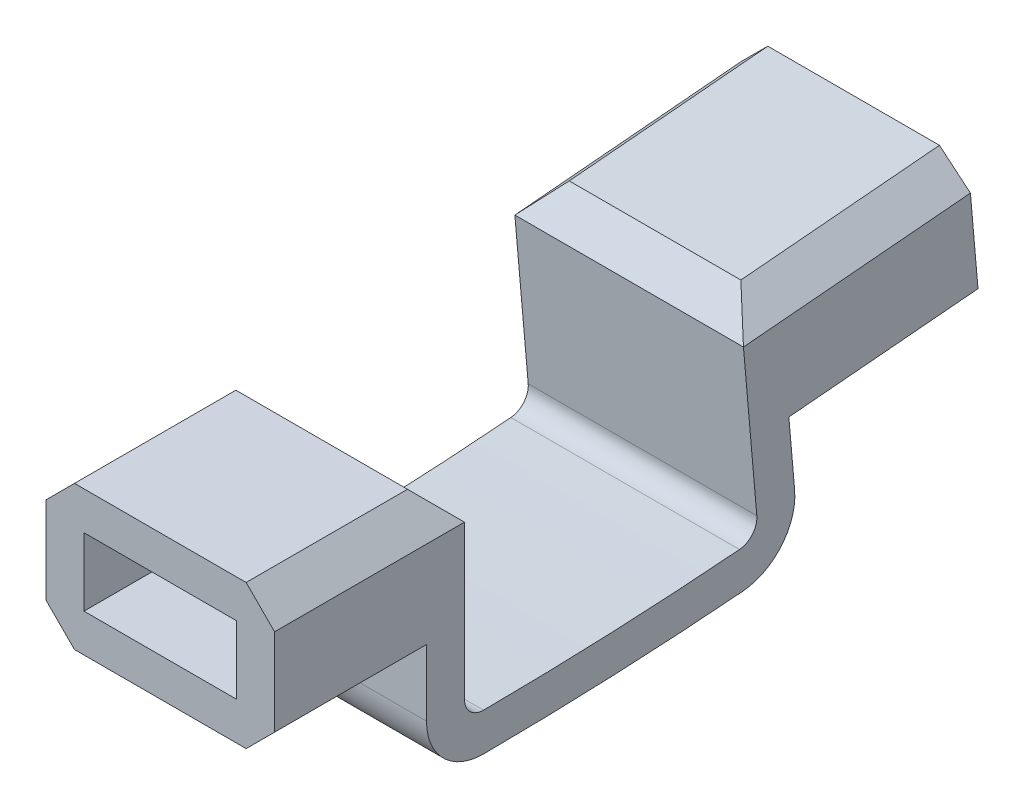
from build123d import *

# Parameters (mm, degrees)
SKETCH1_W           = 12.04
SKETCH1_H           = 7.58
SKETCH1_W_2         = 8.04
SKETCH1_H_2         = 3.58
BOSS_EXTRUDE1_DEPTH = 8
SKETCH1_2_W         = 12.04
SKETCH1_2_H         = 7.58
SKETCH1_2_W_2       = 8.04
SKETCH1_2_H_2       = 3.58
BOSS_EXTRUDE2_DEPTH = 2
EXTRUDE_THIN1_START = -12.04
EXTRUDE_THIN1_DEPTH = 12.04
SKETCH5_W           = 12.04
SKETCH5_H           = 7.58
SKETCH5_W_2         = 8.04
SKETCH5_H_2         = 3.58
BOSS_EXTRUDE4_DEPTH = 10
SKETCH5_4_W         = 12.04
SKETCH5_4_H         = 7.58
BOSS_EXTRUDE5_DEPTH = 2
CHAMFER1_SIZE       = 1.5


with BuildPart() as part:
    # Sketch1 → Boss-Extrude1 (new body)
    with BuildSketch(Plane.XY):
        Rectangle(SKETCH1_W, SKETCH1_H)
        Rectangle(SKETCH1_W_2, SKETCH1_H_2, mode=Mode.SUBTRACT)
    extrude(amount=BOSS_EXTRUDE1_DEPTH)

    # Sketch1<2> → Boss-Extrude2 (add)
    # profile 1 of 2: a face of its own
    with BuildSketch(Plane.XY):
        Rectangle(SKETCH1_2_W, SKETCH1_2_H)
        Rectangle(SKETCH1_2_W_2, SKETCH1_2_H_2, mode=Mode.SUBTRACT)
    # profile 2 of 2: a face of its own
    with BuildSketch(Plane.XY):
        Rectangle(SKETCH1_2_W_2, SKETCH1_2_H_2)
    extrude(amount=-BOSS_EXTRUDE2_DEPTH)

    # Sketch3 → Extrude-Thin1 (add)
    with BuildSketch(Plane(origin=(6.02, 9.81, 0), x_dir=(0, -1, 0), z_dir=(1, 0, 0)).offset(EXTRUDE_THIN1_START)):
        with BuildLine():
            Line((13.6, 2), (15.597169895, 2))
            ThreePointArc((15.597169895, 2), (16.306275023, 2.294897229), (16.597153876, 3.005660165))
            ThreePointArc((16.597153876, 3.005660165), (16.430894398, 9.75), (16.008713261, 16.483166054))
            ThreePointArc((16.008713261, 16.483166054), (15.656994218, 17.16587256), (14.924885462, 17.397845032))
            Line((14.924885462, 17.397845032), (12.935315402, 17.223780206))
            Line((12.935315402, 17.223780206), (12.761003916, 19.216169602))
            Line((12.761003916, 19.216169602), (14.750573976, 19.390234428))
            ThreePointArc((14.750573976, 19.390234428), (16.946900244, 18.694317012), (18.002057373, 16.646197494))
            ThreePointArc((18.002057373, 16.646197494), (18.428990842, 9.837238775), (18.597121838, 3.016980496))
            ThreePointArc((18.597121838, 3.016980496), (17.724485279, 0.884691688), (15.597169895, 0))
            Line((15.597169895, 0), (13.6, 0))
            Line((13.6, 0), (13.6, 2))
        make_face()
    extrude(amount=EXTRUDE_THIN1_DEPTH)



with BuildPart() as body_2:
    # Sketch5 → Boss-Extrude4 (new body)
    with BuildSketch(Plane(origin=(0, -2.104915883, -19.142146491), x_dir=(1, 0, 0), z_dir=(0, -0.08715574274765182, 0.9961946980917462))):
        with Locations((0, 2.940680048)):
            Rectangle(SKETCH5_W, SKETCH5_H)
        with Locations((0, 2.940680048)):
            Rectangle(SKETCH5_W_2, SKETCH5_H_2, mode=Mode.SUBTRACT)
    extrude(amount=-BOSS_EXTRUDE4_DEPTH)


with BuildPart() as part_1:
    add(part.part)

    add(body_2.part)  # Boss-Extrude5 merges body 2
    # Sketch5<4> → Boss-Extrude5 (add)
    with BuildSketch(Plane(origin=(0, -2.104915883, -19.142146491), x_dir=(1, 0, 0), z_dir=(0, -0.08715574274765182, 0.9961946980917462))):
        with Locations((0, 2.940680048)):
            Rectangle(SKETCH5_4_W, SKETCH5_4_H)
    extrude(amount=BOSS_EXTRUDE5_DEPTH)

    # Chamfer1
    chamfer1_edges = [part_1.edges().sort_by_distance(p)[0] for p in [
        (6.02, -2.515225202, -24.197143093),
        (-6.02, -2.515225202, -24.197143093),
        (0, 3.79, -2),
        (6.02, -3.79, 4),
        (-6.02, -3.79, 4),
        (-6.02, 3.79, 3),
        (6.02, 3.79, 3),
        (0, 4.42584041, -16.563139676),
        (6.02, 4.948774866, -22.540307865),
        (-6.02, 4.948774866, -22.540307865),
    ]]
    chamfer(chamfer1_edges, length=CHAMFER1_SIZE)


solid = part_1.part
